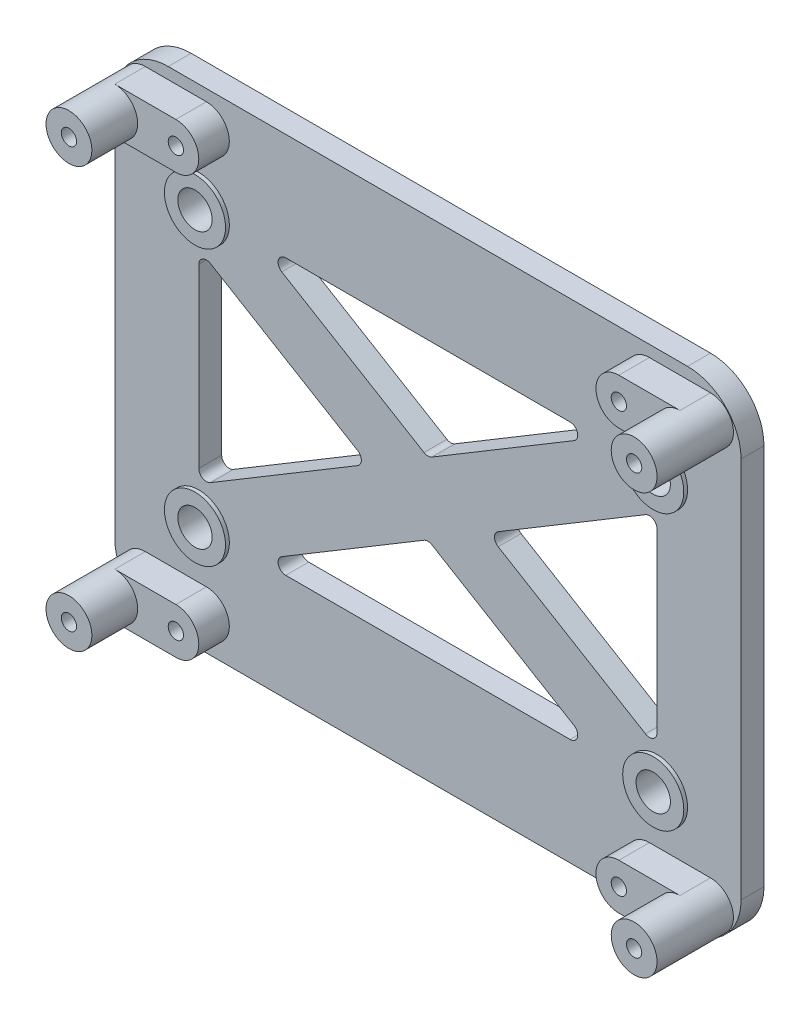
from build123d import *

# Parameters (mm, degrees)
ESBO_O1_W                = 82
ESBO_O1_H                = 64
RESSALTO_EXTRUS_O1_DEPTH = 3
ESBO_O2_R                = 3
ESBO_O2_R_2              = 1
RESSALTO_EXTRUS_O2_DEPTH = 4
ESBO_O3_R                = 3
ESBO_O3_R_2              = 1
RESSALTO_EXTRUS_O3_DEPTH = 10
ESBO_O4_R                = 2.25
CORTE_EXTRUS_O1_DEPTH    = 53.962250707
RESSALTO_EXTRUS_O4_START = 0.5
ESBO_O5_R                = 4
ESBO_O5_R_2              = 2.25
RESSALTO_EXTRUS_O4_DEPTH = 0.5
FILETE1_R                = 7
CORTE_EXTRUS_O2_DEPTH    = 53.962250707
FILETE2_R                = 1
ESBO_O7_R                = 1
RESSALTO_EXTRUS_O5_DEPTH = 4


with BuildPart() as part:
    # Esboço1 → Ressalto-extrusão1 (new body)
    with BuildSketch(Plane.XY):
        Rectangle(ESBO_O1_W, ESBO_O1_H)
    extrude(amount=RESSALTO_EXTRUS_O1_DEPTH)

    # Esboço2 → Ressalto-extrusão2 (add)
    # profile 1 of 4: a face of its own
    with BuildSketch(Plane.XY.offset(3)):
        with Locations(Location((-29, 27.5, 0), (0, 0, 180))):
            Circle(ESBO_O2_R)
        with Locations((-29, 27.5)):
            Circle(ESBO_O2_R_2, mode=Mode.SUBTRACT)
    # profile 2 of 4: a face of its own
    with BuildSketch(Plane.XY.offset(3)):
        with Locations(Location((-29, -27.5, 0), (0, 0, 180))):
            Circle(ESBO_O2_R)
        with Locations(Location((-29, -27.5, 0), (0, 0, 180))):
            Circle(ESBO_O2_R_2, mode=Mode.SUBTRACT)
    # profile 3 of 4: a face of its own
    with BuildSketch(Plane.XY.offset(3)):
        with Locations(Location((29, -27.5, 0), (0, 0, 180))):
            Circle(ESBO_O2_R)
        with Locations((29, -27.5)):
            Circle(ESBO_O2_R_2, mode=Mode.SUBTRACT)
    # profile 4 of 4: a face of its own
    with BuildSketch(Plane.XY.offset(3)):
        with Locations(Location((29, 27.5, 0), (0, 0, 180))):
            Circle(ESBO_O2_R)
        with Locations(Location((29, 27.5, 0), (0, 0, 180))):
            Circle(ESBO_O2_R_2, mode=Mode.SUBTRACT)
    extrude(amount=RESSALTO_EXTRUS_O2_DEPTH)

    # Esboço3 → Ressalto-extrusão3 (add)
    # profile 1 of 4: a face of its own
    with BuildSketch(Plane.XY.offset(3)):
        with Locations(Location((-37, 27.5, 0), (0, 0, 180))):
            Circle(ESBO_O3_R)
        with Locations((-37, 27.5)):
            Circle(ESBO_O3_R_2, mode=Mode.SUBTRACT)
    # profile 2 of 4: a face of its own
    with BuildSketch(Plane.XY.offset(3)):
        with Locations(Location((37, 27.5, 0), (0, 0, 180))):
            Circle(ESBO_O3_R)
        with Locations(Location((37, 27.5, 0), (0, 0, 180))):
            Circle(ESBO_O3_R_2, mode=Mode.SUBTRACT)
    # profile 3 of 4: a face of its own
    with BuildSketch(Plane.XY.offset(3)):
        with Locations(Location((37, -27.5, 0), (0, 0, 180))):
            Circle(ESBO_O3_R)
        with Locations((37, -27.5)):
            Circle(ESBO_O3_R_2, mode=Mode.SUBTRACT)
    # profile 4 of 4: a face of its own
    with BuildSketch(Plane.XY.offset(3)):
        with Locations(Location((-37, -27.5, 0), (0, 0, 180))):
            Circle(ESBO_O3_R)
        with Locations(Location((-37, -27.5, 0), (0, 0, 180))):
            Circle(ESBO_O3_R_2, mode=Mode.SUBTRACT)
    extrude(amount=RESSALTO_EXTRUS_O3_DEPTH)

    # Esboço4 → Corte-extrusão1 (cut, through all)
    with BuildSketch(Plane.XY.offset(3)):
        with Locations((-30, 18)):
            Circle(ESBO_O4_R)
        with Locations(Location((30, 18, 0), (0, 0, 180))):
            Circle(ESBO_O4_R)
        with Locations((30, -18)):
            Circle(ESBO_O4_R)
        with Locations(Location((-30, -18, 0), (0, 0, 180))):
            Circle(ESBO_O4_R)
    extrude(amount=-CORTE_EXTRUS_O1_DEPTH, mode=Mode.SUBTRACT)

    # Esboço5 → Ressalto-extrusão4 (add)
    # profile 1 of 4: a face of its own
    with BuildSketch(Plane.XY.offset(3).offset(RESSALTO_EXTRUS_O4_START)):
        with Locations(Location((-30, 18, 0), (0, 0, 180))):
            Circle(ESBO_O5_R)
        with Locations((-30, 18)):
            Circle(ESBO_O5_R_2, mode=Mode.SUBTRACT)
    # profile 2 of 4: a face of its own
    with BuildSketch(Plane.XY.offset(3).offset(RESSALTO_EXTRUS_O4_START)):
        with Locations(Location((30, 18, 0), (0, 0, 180))):
            Circle(ESBO_O5_R)
        with Locations(Location((30, 18, 0), (0, 0, 180))):
            Circle(ESBO_O5_R_2, mode=Mode.SUBTRACT)
    # profile 3 of 4: a face of its own
    with BuildSketch(Plane.XY.offset(3).offset(RESSALTO_EXTRUS_O4_START)):
        with Locations(Location((-30, -18, 0), (0, 0, 180))):
            Circle(ESBO_O5_R)
        with Locations(Location((-30, -18, 0), (0, 0, 180))):
            Circle(ESBO_O5_R_2, mode=Mode.SUBTRACT)
    # profile 4 of 4: a face of its own
    with BuildSketch(Plane.XY.offset(3).offset(RESSALTO_EXTRUS_O4_START)):
        with Locations(Location((30, -18, 0), (0, 0, 180))):
            Circle(ESBO_O5_R)
        with Locations((30, -18)):
            Circle(ESBO_O5_R_2, mode=Mode.SUBTRACT)
    extrude(amount=-RESSALTO_EXTRUS_O4_DEPTH)

    # Filete1
    filete1_edges = [part.edges().sort_by_distance(p)[0] for p in [
        (41, -32, 1.5),
        (-41, -32, 1.5),
        (-41, 32, 1.5),
        (41, 32, 1.5),
    ]]
    fillet(filete1_edges, radius=FILETE1_R)

    # Esboço6 → Corte-extrusão2 (cut, through all)
    with BuildSketch(Plane.XY.offset(3)):
        Polygon((-30, 13.335238484), (-7.774602526, 0), (-30, -13.335238484), align=None)
        Polygon((-22.225397474, -18), (0, -4.664761516), (22.225397474, -18), align=None)
        Polygon((-22.225397474, 18), (0, 4.664761516), (22.225397474, 18), align=None)
        Polygon((30, -13.335238484), (30, 13.335238484), (7.774602526, 0), align=None)
    extrude(amount=-CORTE_EXTRUS_O2_DEPTH, mode=Mode.SUBTRACT)

    # Filete2
    filete2_edges = [part.edges().sort_by_distance(p)[0] for p in [
        (22.225397474, -18, 1.5),
        (-22.225397474, -18, 1.5),
        (0, -4.664761516, 1.5),
        (-30, -13.335238484, 1.5),
        (-30, 13.335238484, 1.5),
        (-7.774602526, 0, 1.5),
        (30, -13.335238484, 1.5),
        (7.774602526, 0, 1.5),
        (30, 13.335238484, 1.5),
        (-22.225397474, 18, 1.5),
        (22.225397474, 18, 1.5),
        (0, 4.664761516, 1.5),
    ]]
    fillet(filete2_edges, radius=FILETE2_R)

    # Esboço7 → Ressalto-extrusão5 (add)
    # profile 1 of 4: a face of its own
    with BuildSketch(Plane.XY.offset(3)):
        with BuildLine():
            Line((-37, 30.5), (-29, 30.5))
            ThreePointArc((-29, 30.5), (-26, 27.5), (-29, 24.5))
            Line((-29, 24.5), (-37, 24.5))
            ThreePointArc((-37, 24.5), (-40, 27.5), (-37, 30.5))
        make_face()
        with Locations((-37, 27.5)):
            Circle(ESBO_O7_R, mode=Mode.SUBTRACT)
        with Locations((-29, 27.5)):
            Circle(ESBO_O7_R, mode=Mode.SUBTRACT)
    # profile 2 of 4: a face of its own
    with BuildSketch(Plane.XY.offset(3)):
        with BuildLine():
            Line((37, 24.5), (29, 24.5))
            ThreePointArc((29, 24.5), (26, 27.5), (29, 30.5))
            Line((29, 30.5), (37, 30.5))
            ThreePointArc((37, 30.5), (40, 27.5), (37, 24.5))
        make_face()
        with Locations(Location((29, 27.5, 0), (0, 0, 180))):
            Circle(ESBO_O7_R, mode=Mode.SUBTRACT)
        with Locations(Location((37, 27.5, 0), (0, 0, 180))):
            Circle(ESBO_O7_R, mode=Mode.SUBTRACT)
    # profile 3 of 4: a face of its own
    with BuildSketch(Plane.XY.offset(3)):
        with BuildLine():
            Line((37, -30.5), (29, -30.5))
            ThreePointArc((29, -30.5), (26, -27.5), (29, -24.5))
            Line((29, -24.5), (37, -24.5))
            ThreePointArc((37, -24.5), (40, -27.5), (37, -30.5))
        make_face()
        with Locations((37, -27.5)):
            Circle(ESBO_O7_R, mode=Mode.SUBTRACT)
        with Locations((29, -27.5)):
            Circle(ESBO_O7_R, mode=Mode.SUBTRACT)
    # profile 4 of 4: a face of its own
    with BuildSketch(Plane.XY.offset(3)):
        with BuildLine():
            Line((-37, -24.5), (-29, -24.5))
            ThreePointArc((-29, -24.5), (-26, -27.5), (-29, -30.5))
            Line((-29, -30.5), (-37, -30.5))
            ThreePointArc((-37, -30.5), (-40, -27.5), (-37, -24.5))
        make_face()
        with Locations(Location((-29, -27.5, 0), (0, 0, 180))):
            Circle(ESBO_O7_R, mode=Mode.SUBTRACT)
        with Locations(Location((-37, -27.5, 0), (0, 0, 180))):
            Circle(ESBO_O7_R, mode=Mode.SUBTRACT)
    extrude(amount=RESSALTO_EXTRUS_O5_DEPTH)


solid = part.part
